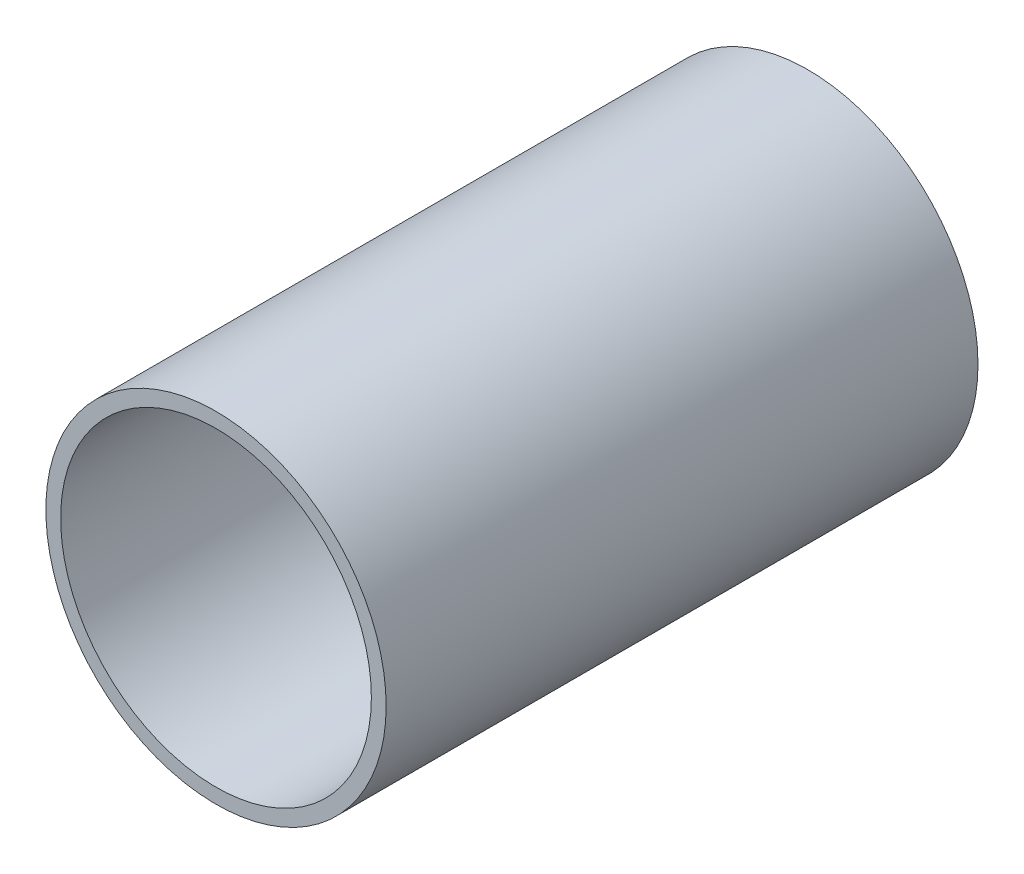
from build123d import *

# Parameters (mm, degrees)
SKETCH1_R           = 29.21
SKETCH1_R_2         = 26.67
BOSS_EXTRUDE1_DEPTH = 50.8


with BuildPart() as part:
    # Sketch1 → Boss-Extrude1 (new, symmetric)
    with BuildSketch(Plane.XY):
        Circle(SKETCH1_R)
        Circle(SKETCH1_R_2, mode=Mode.SUBTRACT)
    extrude(amount=BOSS_EXTRUDE1_DEPTH, both=True)


solid = part.part
